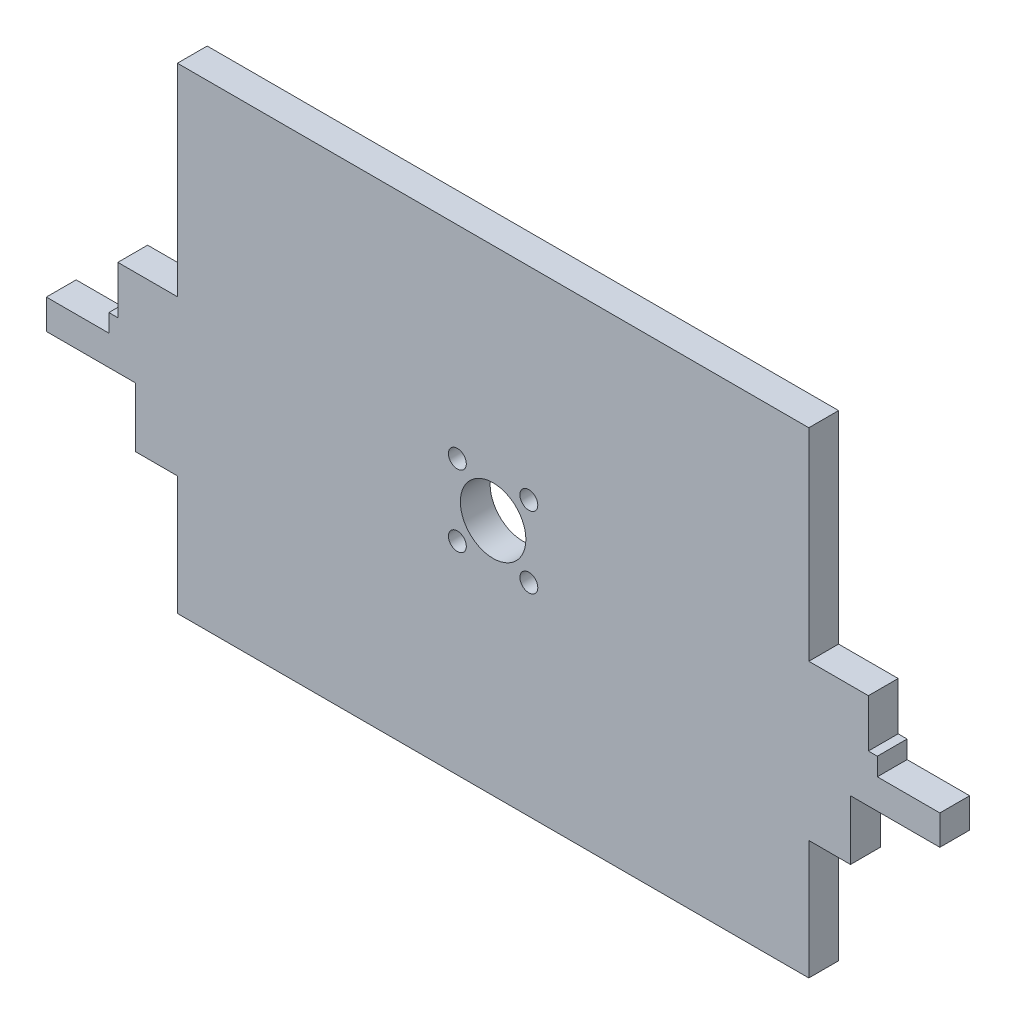
from build123d import *

# Parameters (mm, degrees)
SKETCH_1_W          = 120
SKETCH_1_H          = 90
EXTRUDE_1_DEPTH     = 5
SKETCH_5_W          = 120
SKETCH_5_H          = 10
CUT_EXTRUDE_3_DEPTH = 10
SKETCH_10_W         = 5
SKETCH_10_H         = 5.002587902
EXTRUDE_3_DEPTH     = 15
SKETCH_12_W         = 5
SKETCH_12_H         = 5.002587902
EXTRUDE_4_DEPTH     = 15
SKETCH_14_W         = 3
SKETCH_14_H         = 15.404940373
EXTRUDE_5_DEPTH     = 5
SKETCH_16_W         = 5
SKETCH_16_H         = 29.952587902
CUT_EXTRUDE_5_DEPTH = 10
SKETCH_17_W         = 5
SKETCH_17_H         = 29.952587902
CUT_EXTRUDE_6_DEPTH = 10
SKETCH_18_W         = 10
SKETCH_18_H         = 4
SKETCH_18_W_2       = 7
SKETCH_18_H_2       = 20
CUT_EXTRUDE_7_DEPTH = 10
SKETCH_19_W         = 1.5
SKETCH_19_H         = 3
EXTRUDE_6_DEPTH     = 5
SKETCH_20_R         = 5.5
SKETCH_20_R_2       = 1.5
CUT_EXTRUDE_8_DEPTH = 10


with BuildPart() as part:
    # 草图1 → 凸台-拉伸1 (new body)
    with BuildSketch(Plane.XY):
        Rectangle(SKETCH_1_W, SKETCH_1_H)
    extrude(amount=EXTRUDE_1_DEPTH)

    # 草图5 → 切除-拉伸3 (cut)
    with BuildSketch(Plane(origin=(0, 0, 0), x_dir=(-1, 0, 0), z_dir=(0, 0, -1))):
        with Locations((0, -40)):
            Rectangle(SKETCH_5_W, SKETCH_5_H)
    extrude(amount=-CUT_EXTRUDE_3_DEPTH, mode=Mode.SUBTRACT)

    # 草图10 → 凸台-拉伸3 (add)
    with BuildSketch(Plane(origin=(60, 0, 0), x_dir=(0, 0, -1), z_dir=(1, 0, 0))):
        with Locations((-2.5, -2.501293951)):
            Rectangle(SKETCH_10_W, SKETCH_10_H)
    extrude(amount=EXTRUDE_3_DEPTH)

    # 草图12 → 凸台-拉伸4 (add)
    with BuildSketch(Plane.ZY.offset(60)):
        with Locations((2.5, -2.501293951)):
            Rectangle(SKETCH_12_W, SKETCH_12_H)
    extrude(amount=EXTRUDE_4_DEPTH)

    # 草图14 → 凸台-拉伸5 (add, through all)
    with BuildSketch(Plane(origin=(0, 0, 0), x_dir=(-1, 0, 0), z_dir=(0, 0, -1))):
        with Locations((-61.5, 7.702470187)):
            Rectangle(SKETCH_14_W, SKETCH_14_H)
        with Locations((61.5, 7.702470187)):
            Rectangle(SKETCH_14_W, SKETCH_14_H)
    extrude(amount=-EXTRUDE_5_DEPTH)

    # 草图16 → 切除-拉伸5 (cut)
    with BuildSketch(Plane(origin=(0, 0, 0), x_dir=(-1, 0, 0), z_dir=(0, 0, -1))):
        with Locations((60.5, 30.023706049)):
            Rectangle(SKETCH_16_W, SKETCH_16_H)
        with Locations((-60.5, 30.023706049)):
            Rectangle(SKETCH_16_W, SKETCH_16_H)
    extrude(amount=-CUT_EXTRUDE_5_DEPTH, mode=Mode.SUBTRACT)

    # 草图17 → 切除-拉伸6 (cut)
    with BuildSketch(Plane(origin=(0, 0, 0), x_dir=(-1, 0, 0), z_dir=(0, 0, -1))):
        with Locations((-55.5, 30.023706049)):
            Rectangle(SKETCH_17_W, SKETCH_17_H)
        with Locations((55.5, 30.023706049)):
            Rectangle(SKETCH_17_W, SKETCH_17_H)
    extrude(amount=-CUT_EXTRUDE_6_DEPTH, mode=Mode.SUBTRACT)

    # 草图18 → 切除-拉伸7 (cut)
    with BuildSketch(Plane(origin=(0, 0, 0), x_dir=(-1, 0, 0), z_dir=(0, 0, -1))):
        with Locations((-58, 13.047412098)):
            Rectangle(SKETCH_18_W, SKETCH_18_H)
        with Locations((-56.5, -25)):
            Rectangle(SKETCH_18_W_2, SKETCH_18_H_2)
        with Locations((56.5, -25)):
            Rectangle(SKETCH_18_W_2, SKETCH_18_H_2)
        with Locations((58, 13.047412098)):
            Rectangle(SKETCH_18_W, SKETCH_18_H)
    extrude(amount=-CUT_EXTRUDE_7_DEPTH, mode=Mode.SUBTRACT)

    # 草图19 → 凸台-拉伸6 (add, through all)
    with BuildSketch(Plane(origin=(0, 0, 0), x_dir=(-1, 0, 0), z_dir=(0, 0, -1))):
        with Locations((-63.75, 1.5)):
            Rectangle(SKETCH_19_W, SKETCH_19_H)
        with Locations((63.75, 1.5)):
            Rectangle(SKETCH_19_W, SKETCH_19_H)
    extrude(amount=-EXTRUDE_6_DEPTH)

    # 草图20 → 切除-拉伸8 (cut)
    with BuildSketch(Plane(origin=(0, 0, 0), x_dir=(-1, 0, 0), z_dir=(0, 0, -1))):
        with Locations((0, 5)):
            Circle(SKETCH_20_R)
        with Locations((6, 11)):
            Circle(SKETCH_20_R_2)
        with Locations((6, -1)):
            Circle(SKETCH_20_R_2)
        with Locations((-6, -1)):
            Circle(SKETCH_20_R_2)
        with Locations((-6, 11)):
            Circle(SKETCH_20_R_2)
    extrude(amount=-CUT_EXTRUDE_8_DEPTH, mode=Mode.SUBTRACT)


solid = part.part
